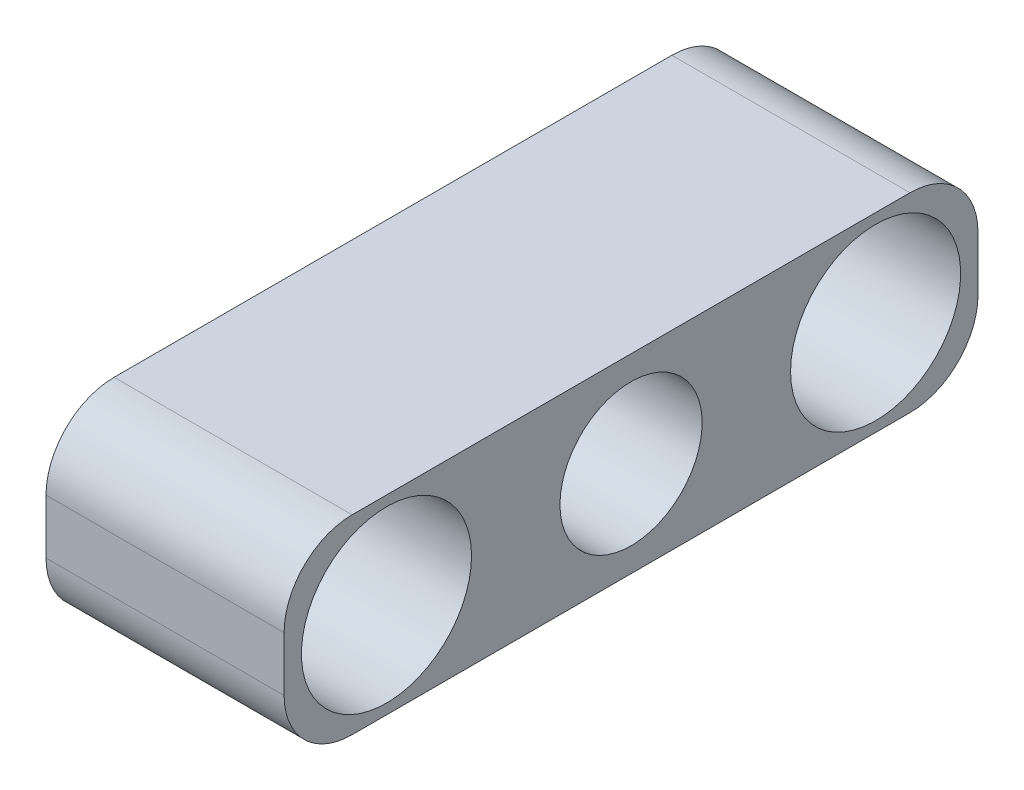
from build123d import *

# Parameters (mm, degrees)
BOSS_EXTRUDE1_START  = -17
BOSS_EXTRUDE1_DEPTH  = 35
SKETCH2_R            = 10.45
CUT_EXTRUDE1_DEPTH   = 30
SKETCH3_R            = 6.5
CUT_EXTRUDE2_DEPTH   = 61.802960454
SKETCH4_R            = 12.5
CUT_EXTRUDE3_DEPTH   = 64.419239983
FILLET5_R            = 10
FILLET6_R            = 10
FILLET5_OF_MIRROR2_R = 10
FILLET6_OF_MIRROR2_R = 10


with BuildPart() as part:
    # Sketch1 → Boss-Extrude1 (new body)
    with BuildSketch(Plane.YZ.offset(BOSS_EXTRUDE1_START)):
        with BuildLine():
            Line((-14, 0), (-14, 51))
            Line((-14, 51), (14, 51))
            Line((14, 51), (14, 0))
            ThreePointArc((14, 0), (0, -14), (-14, 0))
        make_face()
    boss_extrude1 = extrude(amount=BOSS_EXTRUDE1_DEPTH)

    # Sketch2 → Cut-Extrude1 (cut)
    with BuildSketch(Plane.YZ.offset(18)):
        with Locations(Location((0, 0, 0), (0, 0, 270))):
            Circle(SKETCH2_R)
    cut_extrude1 = extrude(amount=-CUT_EXTRUDE1_DEPTH, mode=Mode.SUBTRACT)

    # Sketch3 → Cut-Extrude2 (cut, through all)
    with BuildSketch(Plane.YZ.offset(-12)):
        with Locations(Location((0, 0, 0), (0, 0, 270))):
            Circle(SKETCH3_R)
    cut_extrude2 = extrude(amount=-CUT_EXTRUDE2_DEPTH, mode=Mode.SUBTRACT)

    # Sketch4 → Cut-Extrude3 (cut, through all)
    with BuildSketch(Plane.YZ.offset(18)):
        with Locations(Location((0, 35.95, 0), (0, 0, 270))):
            Circle(SKETCH4_R)
    cut_extrude3 = extrude(amount=-CUT_EXTRUDE3_DEPTH, mode=Mode.SUBTRACT)

    # Fillet5
    fillet5_edges = [part.edges().sort_by_distance(p)[0] for p in [
        (0.5, 14, 51),
    ]]
    fillet(fillet5_edges, radius=FILLET5_R)

    # Fillet6
    fillet6_edges = [part.edges().sort_by_distance(p)[0] for p in [
        (0.5, -14, 51),
    ]]
    fillet(fillet6_edges, radius=FILLET6_R)

    # Mirror2: Boss-Extrude1, Cut-Extrude1, Cut-Extrude2, Cut-Extrude3 across plane
    add(boss_extrude1.mirror(Plane.XY))
    add(cut_extrude1.mirror(Plane.XY), mode=Mode.SUBTRACT)
    add(cut_extrude2.mirror(Plane.XY), mode=Mode.SUBTRACT)
    add(cut_extrude3.mirror(Plane.XY), mode=Mode.SUBTRACT)

    # Fillet5 of Mirror2
    fillet5_of_mirror2_edges = [part.edges().sort_by_distance(p)[0] for p in [
        (0.5, 14, -51),
    ]]
    fillet(fillet5_of_mirror2_edges, radius=FILLET5_OF_MIRROR2_R)

    # Fillet6 of Mirror2
    fillet6_of_mirror2_edges = [part.edges().sort_by_distance(p)[0] for p in [
        (0.5, -14, -51),
    ]]
    fillet(fillet6_of_mirror2_edges, radius=FILLET6_OF_MIRROR2_R)


solid = part.part
